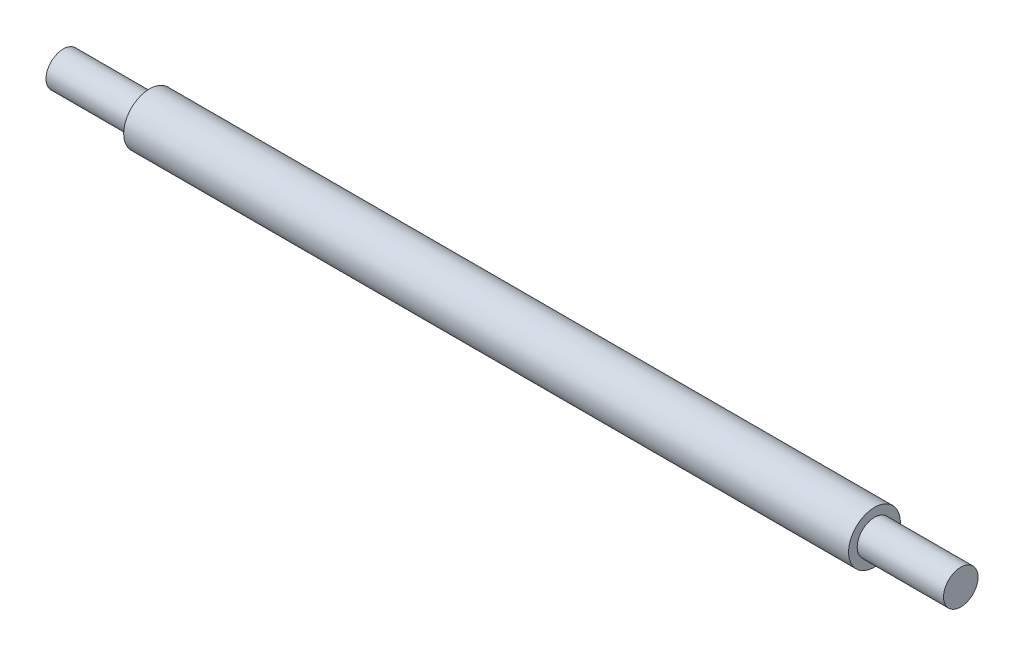
from build123d import *


with BuildPart() as part:
    # Sketch1 → Revolve1 (revolve)
    with BuildSketch(Plane.XY, mode=Mode.PRIVATE) as revolve1_sk:
        Polygon((0, 0), (0, 2), (10, 2), (10, 3), (94, 3), (94, 2), (104, 2), (104, 0), align=None)
    revolve(revolve1_sk.sketch.rotate(Axis((0, 0, 0), (1, 0, 0)), 90), axis=Axis((0, 0, 0), (1, 0, 0)))


solid = part.part
